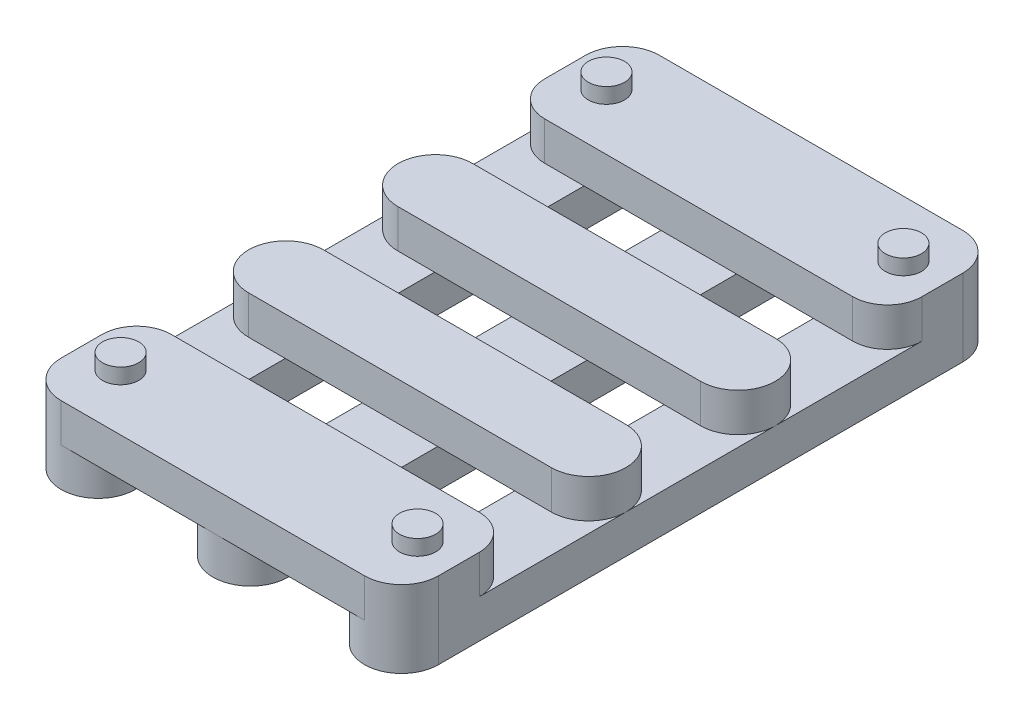
from build123d import *

# Parameters (mm, degrees)
BOSS_EXTRUDE1_DEPTH      = 10
CUT_EXTRUDE3_DEPTH       = 5
BOSS_EXTRUDE6_DEPTH      = 5
BOSS_EXTRUDE6_DEPTH_BACK = 10
SKETCH5_W                = 4.5
SKETCH5_H                = 5
CUT_EXTRUDE5_DEPTH       = 60
CUT_EXTRUDE7_DEPTH       = 5
CUT_EXTRUDE9_DEPTH       = 14
SKETCH9_R                = 2.35
BOSS_EXTRUDE7_DEPTH      = 2
SKETCH12_R               = 2.35
CUT_EXTRUDE10_DEPTH      = 2


with BuildPart() as part:
    # Sketch1 → Boss-Extrude1 (new body)
    with BuildSketch(Plane(origin=(0, 0, 0), x_dir=(1, 0, 0), z_dir=(0, 1, 0))):
        with BuildLine():
            Line((-23.3656, -38.85), (16.6344, -38.85))
            ThreePointArc((16.6344, -38.85), (19.816380515, -37.531980515), (21.1344, -34.35))
            Line((21.1344, -34.35), (21.1344, 34.35))
            ThreePointArc((21.1344, 34.35), (19.816380515, 37.531980515), (16.6344, 38.85))
            Line((16.6344, 38.85), (-23.3656, 38.85))
            ThreePointArc((-23.3656, 38.85), (-26.547580515, 37.531980515), (-27.8656, 34.35))
            Line((-27.8656, 34.35), (-27.8656, -34.35))
            ThreePointArc((-27.8656, -34.35), (-26.547580515, -37.531980515), (-23.3656, -38.85))
        make_face()
    extrude(amount=BOSS_EXTRUDE1_DEPTH)

    # Sketch2 → Cut-Extrude3 (cut)
    with BuildSketch(Plane(origin=(0, 10, 0), x_dir=(1, 0, 0), z_dir=(0, 1, 0))):
        with BuildLine():
            Line((-23.0156, -14.55), (-27.8656, -14.55))
            Line((-27.8656, -14.55), (-27.8656, -28.75))
            ThreePointArc((-27.8656, -28.75), (-26.547580515, -25.568019485), (-23.3656, -24.25))
            Line((-23.3656, -24.25), (16.6344, -24.25))
            ThreePointArc((16.6344, -24.25), (19.816380515, -25.568019485), (21.1344, -28.75))
            Line((21.1344, -28.75), (21.1344, -14.55))
            Line((21.1344, -14.55), (16.2844, -14.55))
            Line((16.2844, -14.55), (-23.0156, -14.55))
        make_face()
        with BuildLine():
            ThreePointArc((-23.0156, -14.55), (-26.445067903, -13.129467874), (-27.8656, -9.699999958))
            Line((-27.8656, -9.699999958), (-27.8656, -14.55))
            Line((-27.8656, -14.55), (-23.0156, -14.55))
        make_face()
        with BuildLine():
            Line((21.1344, -14.55), (21.1344, -9.7))
            ThreePointArc((21.1344, -9.7), (19.713867889, -13.129467889), (16.2844, -14.55))
            Line((16.2844, -14.55), (21.1344, -14.55))
        make_face()
        with BuildLine():
            Line((21.1344, -9.7), (21.1344, -4.85))
            Line((21.1344, -4.85), (16.28440001, -4.85))
            ThreePointArc((16.28440001, -4.85), (19.713867892, -6.270532115), (21.1344, -9.7))
        make_face()
        with BuildLine():
            Line((-23.0156, -4.85), (-27.8656, -4.85))
            Line((-27.8656, -4.85), (-27.8656, -9.699999958))
            ThreePointArc((-27.8656, -9.699999958), (-26.445067874, -6.270532097), (-23.0156, -4.85))
        make_face()
        Polygon((-23.0156, 4.85), (-27.8656, 4.85), (-27.8656, -4.85), (-23.0156, -4.85), (16.28440001, -4.85), (21.1344, -4.85), (21.1344, 4.85), (16.284399974, 4.85), align=None)
        with BuildLine():
            ThreePointArc((-23.0156, 4.85), (-26.445067902, 6.270532124), (-27.8656, 9.700000036))
            Line((-27.8656, 9.700000036), (-27.8656, 4.85))
            Line((-27.8656, 4.85), (-23.0156, 4.85))
        make_face()
        with BuildLine():
            Line((21.1344, 4.85), (21.1344, 9.7))
            ThreePointArc((21.1344, 9.7), (19.71386788, 6.270532102), (16.284399974, 4.85))
            Line((16.284399974, 4.85), (21.1344, 4.85))
        make_face()
        with BuildLine():
            Line((-23.015600011, 14.55), (-27.8656, 14.55))
            Line((-27.8656, 14.55), (-27.8656, 9.700000036))
            ThreePointArc((-27.8656, 9.700000036), (-26.44506788, 13.129467898), (-23.015600011, 14.55))
        make_face()
        with BuildLine():
            Line((16.6344, 24.25), (-23.3656, 24.25))
            ThreePointArc((-23.3656, 24.25), (-26.547580515, 25.568019485), (-27.8656, 28.75))
            Line((-27.8656, 28.75), (-27.8656, 14.55))
            Line((-27.8656, 14.55), (-23.015600011, 14.55))
            Line((-23.015600011, 14.55), (16.2844, 14.55))
            Line((16.2844, 14.55), (21.1344, 14.55))
            Line((21.1344, 14.55), (21.1344, 28.75))
            ThreePointArc((21.1344, 28.75), (19.816380515, 25.568019485), (16.6344, 24.25))
        make_face()
        with BuildLine():
            Line((21.1344, 9.7), (21.1344, 14.55))
            Line((21.1344, 14.55), (16.2844, 14.55))
            ThreePointArc((16.2844, 14.55), (19.713867889, 13.129467889), (21.1344, 9.7))
        make_face()
    extrude(amount=-CUT_EXTRUDE3_DEPTH, mode=Mode.SUBTRACT)

    # Sketch4 → Boss-Extrude6 (add, two sides: drawn at the far end of the back side and taken through both)
    with BuildSketch(Plane.XZ.offset(-BOSS_EXTRUDE6_DEPTH_BACK)):
        with BuildLine():
            ThreePointArc((-27.8656, 34.35), (-26.547580515, 37.531980515), (-23.3656, 38.85))
            Line((-23.3656, 38.85), (-27.8656, 38.85))
            Line((-27.8656, 38.85), (-27.8656, 34.35))
        make_face()
        with BuildLine():
            Line((-23.3656, 35.615611346), (-23.3656, 38.85))
            ThreePointArc((-23.3656, 38.85), (-26.547580515, 37.531980515), (-27.8656, 34.35))
            Line((-27.8656, 34.35), (-27.8656, 34.176611106))
            Line((-27.8656, 34.176611106), (-23.3656, 35.615611346))
        make_face()
        with BuildLine():
            Line((17.428758808, 36.847416441), (16.6344, 38.85))
            ThreePointArc((16.6344, 38.85), (19.816380515, 37.531980515), (21.1344, 34.35))
            Line((21.1344, 34.35), (17.428758808, 36.847416441))
        make_face()
        with BuildLine():
            Line((21.1344, 38.85), (21.1344, 34.35))
            ThreePointArc((21.1344, 34.35), (19.816380515, 37.531980515), (16.6344, 38.85))
            Line((16.6344, 38.85), (21.1344, 38.85))
        make_face()
        with BuildLine():
            Line((16.6344, -34.745010915), (21.1344, -34.35))
            ThreePointArc((21.1344, -34.35), (19.816380515, -37.531980515), (16.6344, -38.85))
            Line((16.6344, -38.85), (16.6344, -34.745010915))
        make_face()
        with BuildLine():
            Line((16.6344, -38.85), (21.1344, -38.85))
            Line((21.1344, -38.85), (21.1344, -34.35))
            ThreePointArc((21.1344, -34.35), (19.816380515, -37.531980515), (16.6344, -38.85))
        make_face()
        with BuildLine():
            Line((-23.3656, -38.85), (-23.156696732, -35.585785164))
            Line((-23.156696732, -35.585785164), (-27.8656, -34.35))
            ThreePointArc((-27.8656, -34.35), (-26.547580515, -37.531980515), (-23.3656, -38.85))
        make_face()
        with BuildLine():
            Line((-27.8656, -34.35), (-27.8656, -38.85))
            Line((-27.8656, -38.85), (-23.3656, -38.85))
            ThreePointArc((-23.3656, -38.85), (-26.547580515, -37.531980515), (-27.8656, -34.35))
        make_face()
    extrude(amount=BOSS_EXTRUDE6_DEPTH + BOSS_EXTRUDE6_DEPTH_BACK)

    # Sketch5 → Cut-Extrude5 (cut)
    with BuildSketch(Plane(origin=(21.1344, 0, 0), x_dir=(0, 0, -1), z_dir=(1, 0, 0))):
        Polygon((34.35, 0), (-34.35, 0), (-34.35, -5), (-38.85, -5), (-38.85, -11.467862175), (41.584838498, -11.467862175), (41.584838498, 0), (38.85, 0), (38.85, -5), (34.35, -5), align=None)
        with Locations((36.6, -2.5)):
            Rectangle(SKETCH5_W, SKETCH5_H)
        with Locations((-36.6, -2.5)):
            Rectangle(SKETCH5_W, SKETCH5_H)
    extrude(amount=-CUT_EXTRUDE5_DEPTH, mode=Mode.SUBTRACT)

    # Sketch6 → Cut-Extrude7 (cut)
    with BuildSketch(Plane.XZ):
        with BuildLine():
            ThreePointArc((-27.8656, 34.05), (-26.45971255, 37.44411255), (-23.0656, 38.85))
            Line((-23.0656, 38.85), (-27.8656, 38.85))
            Line((-27.8656, 38.85), (-27.8656, 34.05))
        make_face()
        with BuildLine():
            Line((-18.2656, 34.05), (-18.2656, 38.85))
            Line((-18.2656, 38.85), (-23.0656, 38.85))
            ThreePointArc((-23.0656, 38.85), (-19.67148745, 37.44411255), (-18.2656, 34.05))
        make_face()
        Polygon((-8.2656, 38.85), (-18.2656, 38.85), (-18.2656, 34.05), (-18.2656, -34.05), (-18.2656, -38.85), (-8.2656, -38.85), (-8.2656, -33.950000026), (-8.2656, 33.95), align=None)
        with BuildLine():
            Line((-3.365599985, 38.85), (-8.2656, 38.85))
            Line((-8.2656, 38.85), (-8.2656, 33.95))
            ThreePointArc((-8.2656, 33.95), (-6.830423222, 37.414823233), (-3.365599985, 38.85))
        make_face()
        with BuildLine():
            Line((1.5344, 38.85), (-3.365599985, 38.85))
            ThreePointArc((-3.365599985, 38.85), (0.099223233, 37.414823222), (1.5344, 33.95))
            Line((1.5344, 33.95), (1.5344, 38.85))
        make_face()
        Polygon((1.5344, 38.85), (1.5344, 33.95), (1.5344, -33.95), (1.5344, -38.85), (11.5344, -38.85), (11.5344, -34.050000018), (11.5344, 34.05), (11.5344, 38.85), align=None)
        with BuildLine():
            Line((16.3344, 38.85), (11.5344, 38.85))
            Line((11.5344, 38.85), (11.5344, 34.05))
            ThreePointArc((11.5344, 34.05), (12.94028745, 37.44411255), (16.3344, 38.85))
        make_face()
        with BuildLine():
            Line((21.1344, 38.85), (16.3344, 38.85))
            ThreePointArc((16.3344, 38.85), (19.72851255, 37.44411255), (21.1344, 34.05))
            Line((21.1344, 34.05), (21.1344, 38.85))
        make_face()
        with BuildLine():
            ThreePointArc((21.1344, -34.05), (19.72851255, -37.44411255), (16.3344, -38.85))
            Line((16.3344, -38.85), (21.1344, -38.85))
            Line((21.1344, -38.85), (21.1344, -34.05))
        make_face()
        with BuildLine():
            Line((11.5344, -34.050000018), (11.5344, -38.85))
            Line((11.5344, -38.85), (16.3344, -38.85))
            ThreePointArc((16.3344, -38.85), (12.940287457, -37.444112556), (11.5344, -34.050000018))
        make_face()
        with BuildLine():
            Line((1.5344, -38.85), (1.5344, -33.95))
            ThreePointArc((1.5344, -33.95), (0.099223245, -37.414823211), (-3.365599951, -38.85))
            Line((-3.365599951, -38.85), (1.5344, -38.85))
        make_face()
        with BuildLine():
            ThreePointArc((-3.365599951, -38.85), (-6.830423201, -37.414823254), (-8.2656, -33.950000026))
            Line((-8.2656, -33.950000026), (-8.2656, -38.85))
            Line((-8.2656, -38.85), (-3.365599951, -38.85))
        make_face()
        with BuildLine():
            Line((-18.2656, -38.85), (-18.2656, -34.05))
            ThreePointArc((-18.2656, -34.05), (-19.67148745, -37.44411255), (-23.0656, -38.85))
            Line((-23.0656, -38.85), (-18.2656, -38.85))
        make_face()
        with BuildLine():
            ThreePointArc((-23.0656, -38.85), (-26.459712556, -37.444112543), (-27.8656, -34.049999982))
            Line((-27.8656, -34.049999982), (-27.8656, -38.85))
            Line((-27.8656, -38.85), (-23.0656, -38.85))
        make_face()
    extrude(amount=-CUT_EXTRUDE7_DEPTH, mode=Mode.SUBTRACT)

    # Sketch8 → Cut-Extrude9 (cut)
    with BuildSketch(Plane.XZ):
        with BuildLine():
            Line((-27.8656, 38.85), (-27.8656, 34.05))
            ThreePointArc((-27.8656, 34.05), (-26.45971255, 37.44411255), (-23.0656, 38.85))
            Line((-23.0656, 38.85), (-27.8656, 38.85))
        make_face()
        with BuildLine():
            Line((21.1344, 34.05), (21.1344, 38.85))
            Line((21.1344, 38.85), (16.3344, 38.85))
            ThreePointArc((16.3344, 38.85), (19.72851255, 37.44411255), (21.1344, 34.05))
        make_face()
        with BuildLine():
            Line((16.3344, -38.85), (21.1344, -38.85))
            Line((21.1344, -38.85), (21.1344, -34.05))
            ThreePointArc((21.1344, -34.05), (19.72851255, -37.44411255), (16.3344, -38.85))
        make_face()
        with BuildLine():
            Line((-27.8656, -34.05), (-27.8656, -38.85))
            Line((-27.8656, -38.85), (-23.0656, -38.85))
            ThreePointArc((-23.0656, -38.85), (-26.45971255, -37.44411255), (-27.8656, -34.05))
        make_face()
    extrude(amount=-CUT_EXTRUDE9_DEPTH, mode=Mode.SUBTRACT)

    # Sketch9 → Boss-Extrude7 (add)
    with BuildSketch(Plane(origin=(0, 10, 0), x_dir=(1, 0, 0), z_dir=(0, 1, 0))):
        with Locations(Location((-22.6506, 31.55, 0), (0, 0, 270))):
            Circle(SKETCH9_R)
        with Locations(Location((15.9194, 31.55, 0), (0, 0, 270))):
            Circle(SKETCH9_R)
        with Locations(Location((-22.6506, -31.55, 0), (0, 0, 270))):
            Circle(SKETCH9_R)
        with Locations(Location((15.9194, -31.55, 0), (0, 0, 270))):
            Circle(SKETCH9_R)
    extrude(amount=BOSS_EXTRUDE7_DEPTH)

    # Sketch12 → Cut-Extrude10 (cut)
    with BuildSketch(Plane.XZ):
        with Locations(Location((15.9194, 31.55, 0), (0, 0, 90))):
            Circle(SKETCH12_R)
        with Locations(Location((-22.6506, -31.55, 0), (0, 0, 90))):
            Circle(SKETCH12_R)
        with Locations(Location((-22.6506, 31.55, 0), (0, 0, 90))):
            Circle(SKETCH12_R)
        with Locations(Location((15.9194, -31.584685618, 0), (0, 0, 270))):
            Circle(SKETCH12_R)
    extrude(amount=-CUT_EXTRUDE10_DEPTH, mode=Mode.SUBTRACT)


solid = part.part
